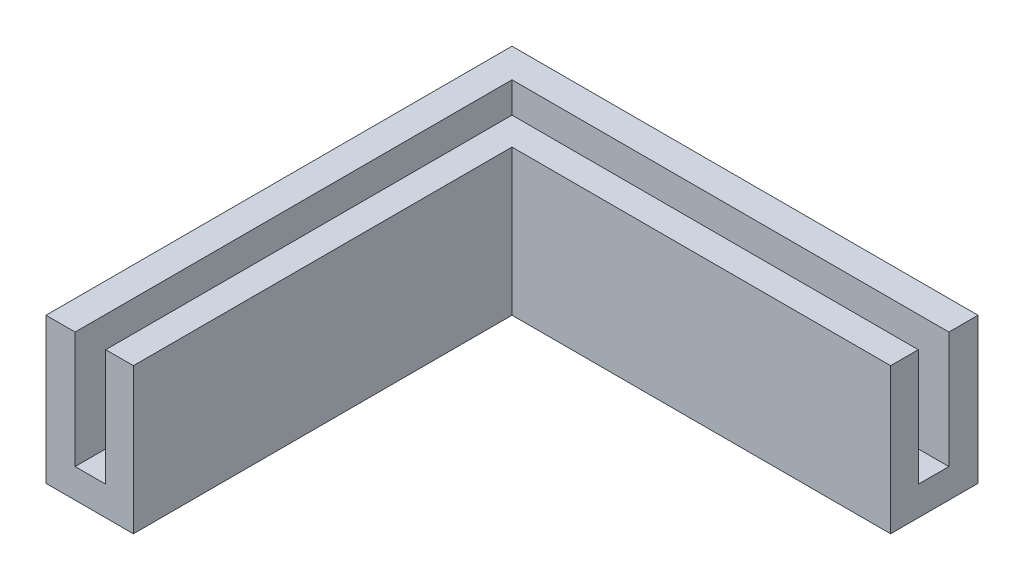
from build123d import *

# Parameters (mm, degrees)
BOSS_EXTRUDE1_DEPTH = 2
BOSS_EXTRUDE2_DEPTH = 8


with BuildPart() as part:
    # Sketch1 → Boss-Extrude1 (new body)
    with BuildSketch(Plane(origin=(0, 0, 0), x_dir=(1, 0, 0), z_dir=(0, 1, 0))):
        Polygon((0, 0), (32, 0), (32, -6), (6, -6), (6, -32), (0, -32), align=None)
    extrude(amount=BOSS_EXTRUDE1_DEPTH)

    # Sketch2 → Boss-Extrude2 (add)
    with BuildSketch(Plane(origin=(0, 2, 0), x_dir=(1, 0, 0), z_dir=(0, 1, 0))):
        Polygon((2, -32), (2, -2), (32, -2), (32, 0), (0, 0), (0, -32), align=None)
        Polygon((32, -4.1), (4.1, -4.1), (4.1, -32), (6, -32), (6, -6), (32, -6), align=None)
    extrude(amount=BOSS_EXTRUDE2_DEPTH)


solid = part.part
